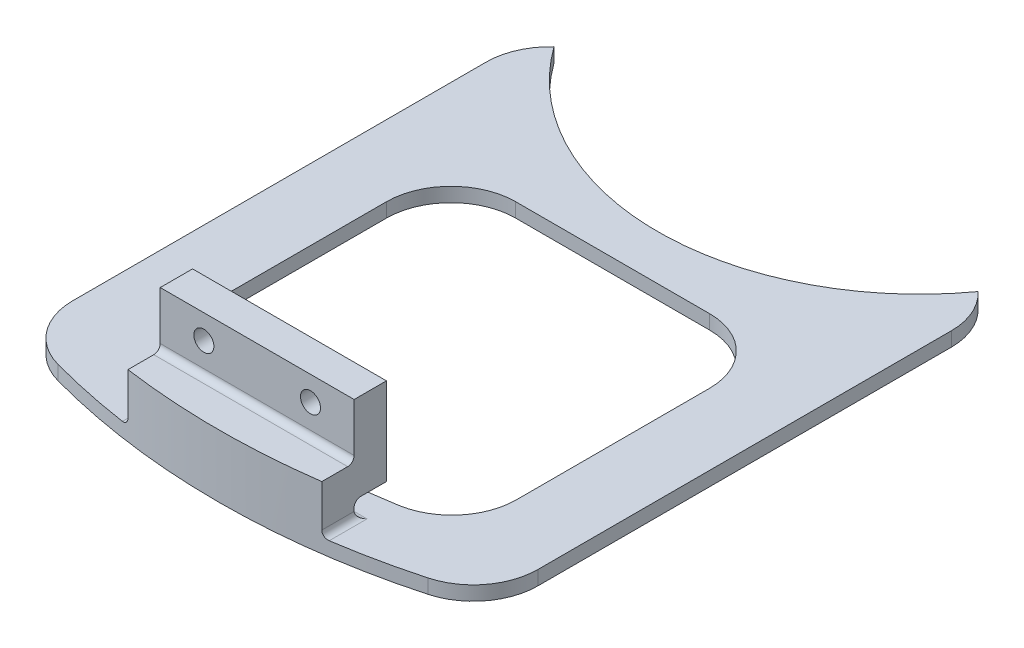
from build123d import *

# Parameters (mm, degrees)
EXTRUDE_1_DEPTH             = 2.2000000000000006
EXTRUDE_2_DEPTH             = 16.000000000000004
SKETCH_3_W                  = 30
SKETCH_3_H                  = 13.500000000000002
EXTRUDE_3_DEPTH             = 5
CUT_EXTRUDE_START           = -8.5
CUT_EXTRUDE_1_DEPTH         = 8.5
CUT_EXTRUDE_2_DEPTH         = 88.46305189948819
HOLE_WIZARD_3_1_3_1_1_D     = 3.1
HOLE_WIZARD_3_1_3_1_1_DEPTH = 11.041658668
FILLET_1_R                  = 1
FILLET_2_R                  = 10


with BuildPart() as part:
    # 草图1 → 凸台-拉伸1 (new body)
    with BuildSketch(Plane.XZ.offset(11.45)):
        with BuildLine():
            Line((-27.748687791341045, 4.896974351176933), (-27.748687791341048, -66.4009079535447))
            ThreePointArc((-27.748687791341048, -66.4009079535447), (-26.915275099995267, -70.3976162382234), (-24.55395236877715, -73.7281430412905))
            ThreePointArc((-24.55395236877715, -73.7281430412905), (8.250000000000021, -56.98000000000004), (41.0539523687772, -73.7281430412905))
            ThreePointArc((41.0539523687772, -73.7281430412905), (43.41527509999529, -70.3976162382234), (44.24868779134105, -66.4009079535447))
            Line((44.24868779134105, -66.4009079535447), (44.24868779134099, 4.896974351176947))
            ThreePointArc((44.24868779134099, 4.896974351176947), (8.249999999999982, 11.041658667751605), (-27.748687791341045, 4.896974351176933))
        make_face()
    extrude(amount=-EXTRUDE_1_DEPTH)

    # 草图2 → 凸台-拉伸2 (add)
    with BuildSketch(Plane(origin=(0, -9.25, 0), x_dir=(-1, 0, 0), z_dir=(0, 1, 0))):
        with BuildLine():
            Line((6.75, 5), (-23.25, 5))
            Line((-23.25, 5), (-23.25, 9.99999999999994))
            ThreePointArc((-23.25, 9.99999999999994), (-8.249999999999993, 11.041658667751605), (6.749999999999999, 9.99999999999994))
            Line((6.749999999999999, 9.99999999999994), (6.75, 5))
        make_face()
    extrude(amount=EXTRUDE_2_DEPTH)

    # 草图3 → 凸台-拉伸3 (add)
    with BuildSketch(Plane(origin=(0, 0, 5), x_dir=(-1, 0, 0), z_dir=(0, 0, -1))):
        with Locations((-8.25, 0)):
            Rectangle(SKETCH_3_W, SKETCH_3_H)
    extrude(amount=EXTRUDE_3_DEPTH)

    # 草图4 → 切除-拉伸1 (cut)
    with BuildSketch(Plane(origin=(0, 6.750000000000004, 0), x_dir=(-1, 0, 0), z_dir=(0, 1, 0)).offset(CUT_EXTRUDE_START)):
        with BuildLine():
            Line((-23.25, 9.99999999999994), (-23.25, 5))
            Line((-23.25, 5), (6.75, 5))
            Line((6.75, 5), (6.749999999999999, 9.99999999999994))
            ThreePointArc((6.749999999999999, 9.99999999999994), (-8.249999999999993, 11.041658667751605), (-23.25, 9.99999999999994))
        make_face()
    extrude(amount=CUT_EXTRUDE_1_DEPTH, mode=Mode.SUBTRACT)

    # 草图5 → 切除-拉伸2 (cut, through all)
    with BuildSketch(Plane(origin=(0, -9.25, 0), x_dir=(-1, 0, 0), z_dir=(0, 1, 0))):
        with BuildLine():
            Line((-33.25000000000001, -2.0737612102855603), (-33.25, -50))
            Line((-33.25, -50), (16.75, -50))
            Line((16.75, -50), (16.749999999999993, -2.073761210285574))
            ThreePointArc((16.749999999999993, -2.073761210285574), (-8.249999999999995, 1.1473308976777048), (-33.25000000000001, -2.0737612102855603))
        make_face()
    extrude(amount=-CUT_EXTRUDE_2_DEPTH, mode=Mode.SUBTRACT)

    # Ø3.1 (3.1) 直径孔1
    with Locations(Plane(origin=(0, 0, 0), x_dir=(-1, 0, 0), z_dir=(0, 0, -1))):
        with Locations((-16.5, 3), (0, 3)):
            Hole(HOLE_WIZARD_3_1_3_1_1_D / 2, depth=HOLE_WIZARD_3_1_3_1_1_DEPTH)

    # 圆角1
    fillet_1_edges = [part.edges().sort_by_distance(p)[0] for p in [
        (-6.75, -9.25, 7.49999999999997),
        (23.25, -9.25, 7.49999999999997),
        (8.25, -9.25, 5),
        (8.25, -6.75, 5),
        (8.25, -1.7499999999999956, 5),
    ]]
    fillet(fillet_1_edges, radius=FILLET_1_R)

    # 圆角2
    fillet_2_edges = [part.edges().sort_by_distance(p)[0] for p in [
        (44.24868779134099, -10.35, 4.896974351176949),
        (-27.748687791341048, -10.35, 4.896974351176935),
        (33.25, -10.35, -2.0737612102855643),
        (-16.749999999999993, -10.35, -2.073761210285571),
        (-16.75, -10.35, -50),
        (33.25, -10.35, -50),
    ]]
    fillet(fillet_2_edges, radius=FILLET_2_R)


solid = part.part
